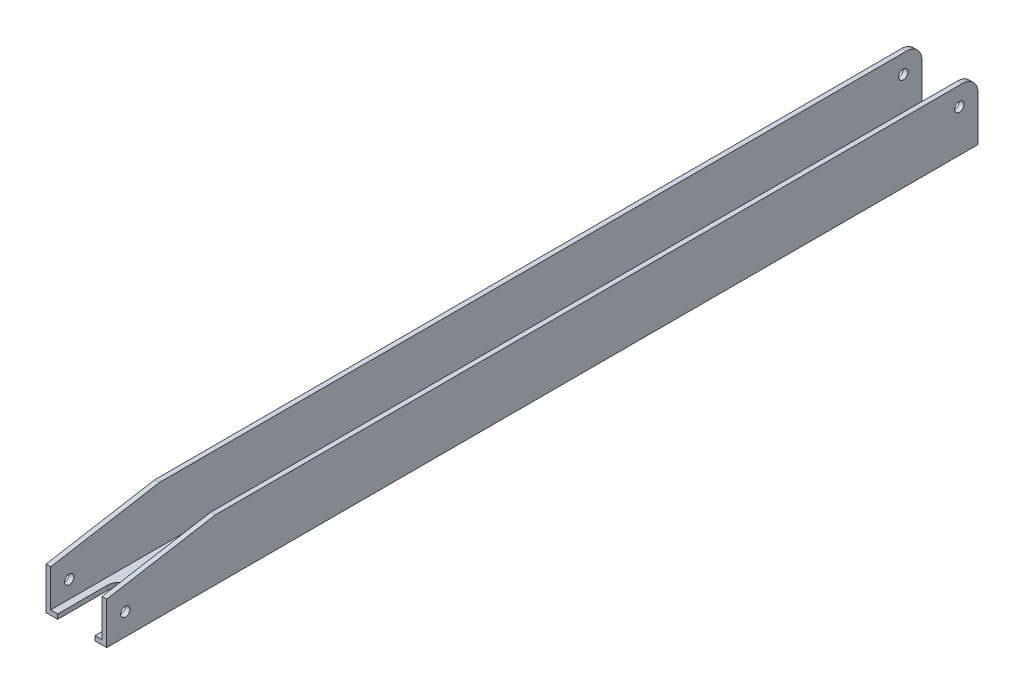
from build123d import *

# Parameters (mm, degrees)
EXTRU_MINCE1_DEPTH      = 280
ESQUISSE2_R             = 1.5
ENL_V_MAT_EXTRU_1_DEPTH = 281.847489752
ESQUISSE3_R             = 1.5
ENL_V_MAT_EXTRU_2_DEPTH = 282.354758268
CONG_1_R                = 5


with BuildPart() as part:
    # Esquisse1 → Extru.-Mince1 (new body)
    with BuildSketch(Plane.XY):
        Polygon((-9.75, 19.5), (-9.75, 0), (9.75, 0), (9.75, 19.5), (8.25, 19.5), (8.25, 1.5), (-8.25, 1.5), (-8.25, 19.5), align=None)
    extrude(amount=EXTRU_MINCE1_DEPTH)

    # Esquisse2 → Enlèv. mat.-Extru.1 (cut, through all)
    with BuildSketch(Plane.XZ):
        with Locations(Location((0, 223, 0), (0, 0, 270))):
            Circle(ESQUISSE2_R)
        with Locations(Location((0, 205, 0), (0, 0, 270))):
            Circle(ESQUISSE2_R)
        with Locations(Location((0, 24, 0), (0, 0, 270))):
            Circle(ESQUISSE2_R)
        with Locations(Location((0, 174, 0), (0, 0, 270))):
            Circle(ESQUISSE2_R)
        with BuildLine():
            Line((-6, 280), (6, 280))
            Line((6, 280), (6, 264))
            ThreePointArc((6, 264), (4.828427125, 261.171572875), (2, 260))
            Line((2, 260), (-2, 260))
            ThreePointArc((-2, 260), (-4.828427125, 261.171572875), (-6, 264))
            Line((-6, 264), (-6, 280))
        make_face()
    extrude(amount=-ENL_V_MAT_EXTRU_1_DEPTH, mode=Mode.SUBTRACT)

    # Esquisse3 → Enlèv. mat.-Extru.2 (cut, through all)
    with BuildSketch(Plane(origin=(9.75, 0, 0), x_dir=(0, 0, -1), z_dir=(1, 0, 0))):
        with Locations(Location((-274, 7, 0), (0, 0, 90))):
            Circle(ESQUISSE3_R)
        with Locations(Location((-6, 13.5, 0), (0, 0, 90))):
            Circle(ESQUISSE3_R)
        Polygon((-280, 13.5), (-280, 19.5), (-245, 19.5), align=None)
    extrude(amount=-ENL_V_MAT_EXTRU_2_DEPTH, mode=Mode.SUBTRACT)

    # Congé1
    cong_1_edges = [part.edges().sort_by_distance(p)[0] for p in [
        (-9, 19.5, 0),
        (9, 19.5, 0),
    ]]
    fillet(cong_1_edges, radius=CONG_1_R)


solid = part.part
